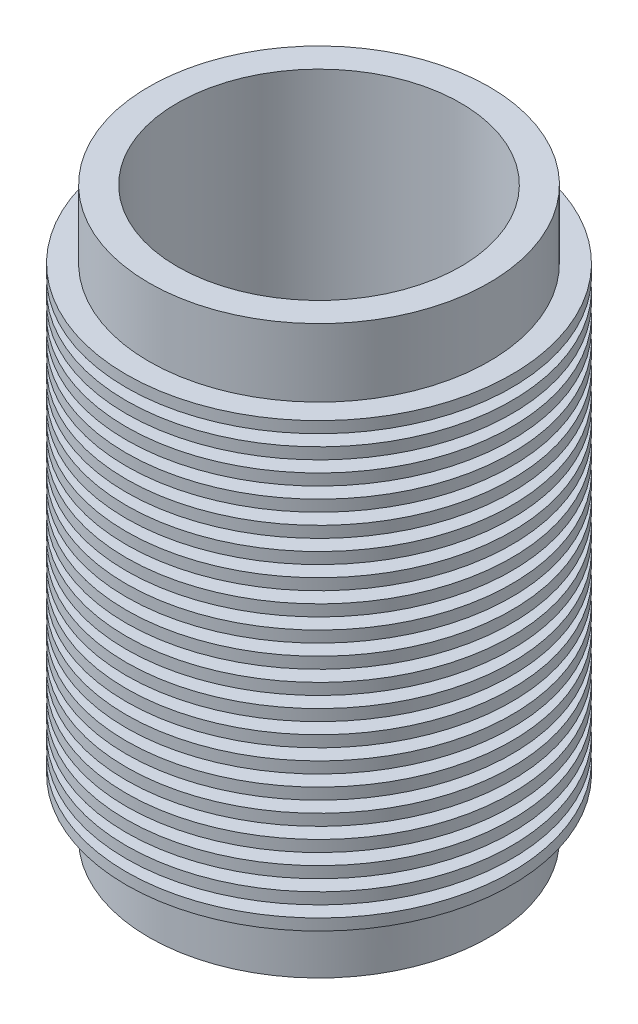
from build123d import *

# Parameters (mm, degrees)
EXTRUDE1_DEPTH          = 31.75
EXTRUDE1_DEPTH_BACK     = 31.75
SKETCH1_R               = 19.05
CUT_EXTRUDE1_DEPTH      = 42.639734629
CUT_EXTRUDE1_DEPTH_BACK = 42.639734629
SKETCH2_R               = 15.875
SKETCH3_R               = 21.59
SKETCH3_R_2             = 19.05
EXTRUDE_THIN1_DEPTH     = 1.27
LPATTERN1_COUNT         = 11
LPATTERN1_PITCH         = 2.54
LPATTERN1_COL_COUNT     = 10
LPATTERN1_COL_PITCH     = 2.54


with BuildPart() as part:
    # Sketch1 → Extrude1 (new, two sides: drawn at the far end of the back side and taken through both)
    with BuildSketch(Plane(origin=(0, 0, 0), x_dir=(1, 0, 0), z_dir=(0, 1, 0)).offset(-EXTRUDE1_DEPTH_BACK)):
        with Locations(Location((0, 0, 0), (0, 0, 270))):
            Circle(SKETCH1_R)
    extrude(amount=EXTRUDE1_DEPTH + EXTRUDE1_DEPTH_BACK)

    # Sketch2 → Cut-Extrude1 (cut, two sides: drawn at the far end of the back side and taken through both)
    with BuildSketch(Plane(origin=(0, 0, 0), x_dir=(1, 0, 0), z_dir=(0, 1, 0)).offset(-CUT_EXTRUDE1_DEPTH_BACK)):
        with Locations(Location((0, 0, 0), (0, 0, 270))):
            Circle(SKETCH2_R)
    extrude(amount=CUT_EXTRUDE1_DEPTH + CUT_EXTRUDE1_DEPTH_BACK, mode=Mode.SUBTRACT)

    # Sketch3 → Extrude-Thin1 (add)
    with BuildSketch(Plane(origin=(0, 0, 0), x_dir=(1, 0, 0), z_dir=(0, 1, 0))):
        Circle(SKETCH3_R)
        Circle(SKETCH3_R_2, mode=Mode.SUBTRACT)
    extrude_thin1 = extrude(amount=EXTRUDE_THIN1_DEPTH)

    # LPattern1: Extrude-Thin1 ×11
    with Locations(*[(0, -i * LPATTERN1_PITCH, 0) for i in range(1, LPATTERN1_COUNT)]):
        add(extrude_thin1)

    # LPattern1 col: Extrude-Thin1 ×10
    with Locations(*[(0, i * LPATTERN1_COL_PITCH, 0) for i in range(1, LPATTERN1_COL_COUNT)]):
        add(extrude_thin1)


solid = part.part
